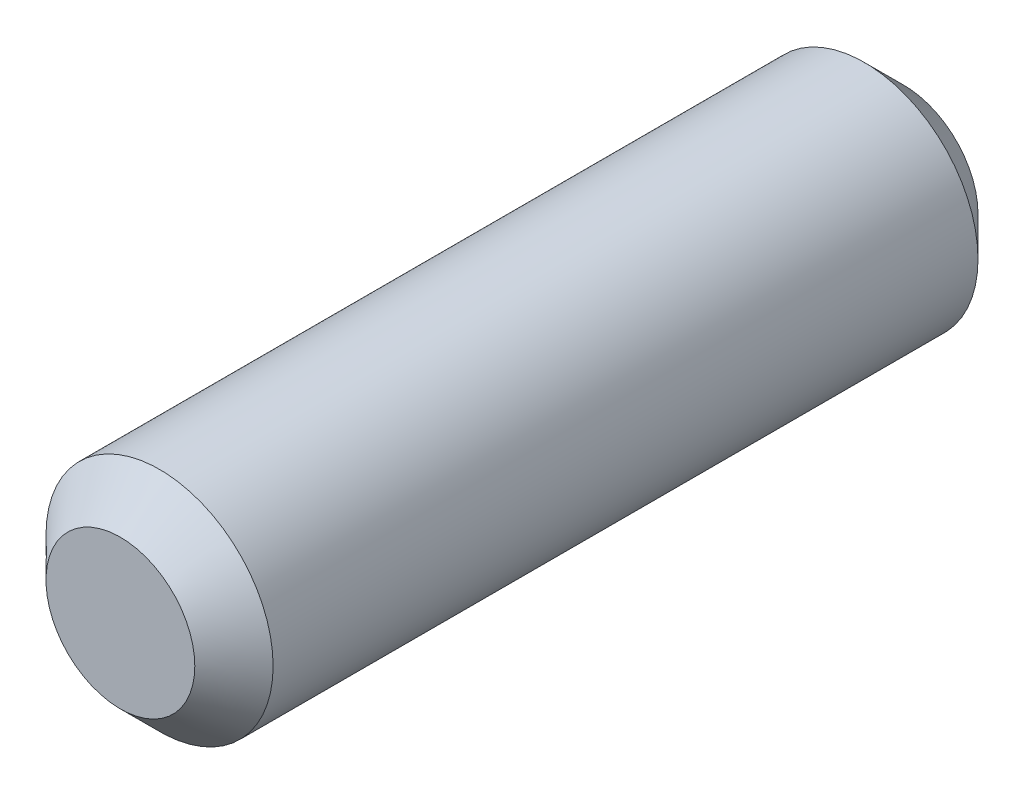
from build123d import *

# Parameters (mm, degrees)
ESQUISSE1_R        = 1.45
BOSS_EXTRU_1_DEPTH = 10
CHANFREIN1_SIZE    = 0.5


with BuildPart() as part:
    # Esquisse1 → Boss.-Extru.1 (new body)
    with BuildSketch(Plane.XY):
        Circle(ESQUISSE1_R)
    extrude(amount=BOSS_EXTRU_1_DEPTH)

    # Chanfrein1
    chanfrein1_edges = [part.edges().sort_by_distance(p)[0] for p in [
        (-1.45, 0, 0),
        (-1.45, 0, 10),
    ]]
    chamfer(chanfrein1_edges, length=CHANFREIN1_SIZE)


solid = part.part
